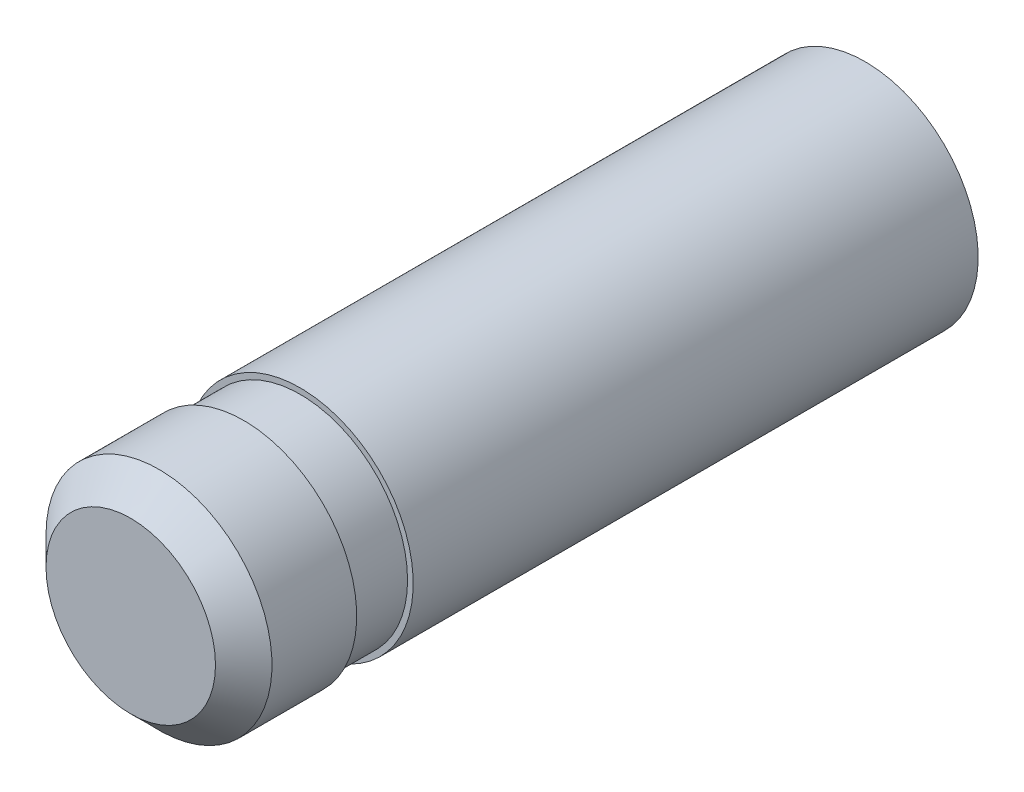
from build123d import *

# Parameters (mm, degrees)
SKETCH2_R           = 2
BOSS_EXTRUDE1_DEPTH = 13
CUT_EXTRUDE1_START  = -10
SKETCH3_OUTSIDE_W   = 8.836
SKETCH3_OUTSIDE_H   = 8.836
SKETCH3_OUTSIDE_R   = 1.9
CUT_EXTRUDE1_DEPTH  = 1
CHAMFER1_SIZE       = 0.5


with BuildPart() as part:
    # Sketch2 → Boss-Extrude1 (new body)
    with BuildSketch(Plane.XY):
        with Locations(Location((0, 0, 0), (0, 0, 180))):
            Circle(SKETCH2_R)
    extrude(amount=BOSS_EXTRUDE1_DEPTH)

    # Sketch3 outside → Cut-Extrude1 (cut)
    with BuildSketch(Plane(origin=(0, 0, 0), x_dir=(-1, 0, 0), z_dir=(0, 0, -1)).offset(CUT_EXTRUDE1_START)):
        Rectangle(SKETCH3_OUTSIDE_W, SKETCH3_OUTSIDE_H)
        Circle(SKETCH3_OUTSIDE_R, mode=Mode.SUBTRACT)
    extrude(amount=-CUT_EXTRUDE1_DEPTH, mode=Mode.SUBTRACT)

    # Chamfer1
    chamfer1_edges = [part.edges().sort_by_distance(p)[0] for p in [
        (2, 0, 13),
    ]]
    chamfer(chamfer1_edges, length=CHAMFER1_SIZE)


solid = part.part
